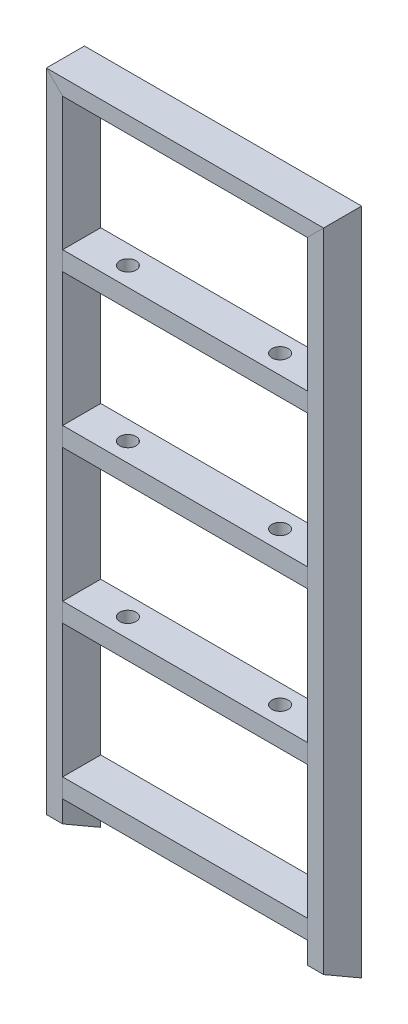
from build123d import *

# Parameters (mm, degrees)
SKETCH3_W               = 38.1
SKETCH3_H               = 88.9
SKETCH10_W              = 571.5
SKETCH10_H              = 183.393381717
CUT_EXTRUDE6_DEPTH      = 1580.172357597
CUT_EXTRUDE7_DEPTH      = 1675.065230211
CUT_EXTRUDE7_DEPTH_BACK = 1675.065230211
SKETCH11_W              = 88.9
SKETCH11_H              = 44.45
BOSS_EXTRUDE1_DEPTH     = 571.5
LPATTERN1_COUNT         = 4
LPATTERN1_PITCH         = 355.6
SKETCH12_R              = 19.05
CUT_EXTRUDE8_DEPTH      = 990.6


with BuildPart() as part:
    # Sweep1: sweep along a path in Sketch2
    with BuildLine(Plane.XY) as sweep1_path:
        Line((-304.8, 0), (304.8, 0))
        Line((304.8, 0), (304.8, -1524))
        Line((304.8, -1524), (-304.8, -1524))
        Line((-304.8, -1524), (-304.8, 0))
    # Sketch3 → Sweep1 (sweep)
    with BuildSketch(Plane(origin=(0, 0, 0), x_dir=(1, 0, 0), z_dir=(0, 1, 0))):
        with Locations((304.8, 0)):
            Rectangle(SKETCH3_W, SKETCH3_H)
    sweep(path=sweep1_path.line, transition=Transition.RIGHT)

    # Sketch10 → Cut-Extrude6 (cut, through all)
    with BuildSketch(Plane.XY.offset(44.45)):
        with Locations((0, -1561.428423028)):
            Rectangle(SKETCH10_W, SKETCH10_H)
    extrude(amount=-CUT_EXTRUDE6_DEPTH, mode=Mode.SUBTRACT)

    # Sketch9 → Cut-Extrude7 (cut, two sides: drawn at the far end of the back side and taken through both)
    with BuildSketch(Plane(origin=(323.85, 0, 0), x_dir=(0, 0, -1), z_dir=(1, 0, 0)).offset(-CUT_EXTRUDE7_DEPTH_BACK)):
        Polygon((2763.124803814, -3112.677629821), (44.45, -1543.05), (-44.45, -1491.723561069), (-2763.124803814, 77.904068752), (-5902.380063457, -5359.445538876), (-376.130455828, -8550.02723745), align=None)
    extrude(amount=CUT_EXTRUDE7_DEPTH + CUT_EXTRUDE7_DEPTH_BACK, mode=Mode.SUBTRACT)


with BuildPart() as body_2:
    # Sketch11 → Boss-Extrude1 (new body)
    with BuildSketch(Plane.ZY.offset(-285.75)):
        with Locations((0, -1418.698561069)):
            Rectangle(SKETCH11_W, SKETCH11_H)
    boss_extrude1 = extrude(amount=BOSS_EXTRUDE1_DEPTH)


with BuildPart() as lpattern1_1:
    # LPattern1: pattern copy
    add(boss_extrude1.moved(Location(Vector(0, 1, 0) * (1 * LPATTERN1_PITCH))))


with BuildPart() as lpattern1_2:
    # LPattern1: pattern copy
    add(boss_extrude1.moved(Location(Vector(0, 1, 0) * (2 * LPATTERN1_PITCH))))


with BuildPart() as lpattern1_3:
    # LPattern1: pattern copy
    add(boss_extrude1.moved(Location(Vector(0, 1, 0) * (3 * LPATTERN1_PITCH))))


with BuildPart() as cut_extrude8_tool:
    # Sketch12 → Cut-Extrude8 (new body)
    with BuildSketch(Plane.XZ.offset(1085.323561069)):
        with Locations((177.8, 0)):
            Circle(SKETCH12_R)
        with Locations((-177.8, 0)):
            Circle(SKETCH12_R)
    extrude(amount=-CUT_EXTRUDE8_DEPTH)


with BuildPart() as lpattern1_1_1:
    add(lpattern1_1.part)

    # Cut-Extrude8: cut by cut_extrude8_tool
    add(cut_extrude8_tool.part, mode=Mode.SUBTRACT)


with BuildPart() as lpattern1_2_1:
    add(lpattern1_2.part)

    # Cut-Extrude8: cut by cut_extrude8_tool
    add(cut_extrude8_tool.part, mode=Mode.SUBTRACT)


with BuildPart() as lpattern1_3_1:
    add(lpattern1_3.part)

    # Cut-Extrude8: cut by cut_extrude8_tool
    add(cut_extrude8_tool.part, mode=Mode.SUBTRACT)


solid = Compound([part.part, body_2.part, lpattern1_1_1.part, lpattern1_2_1.part, lpattern1_3_1.part])
